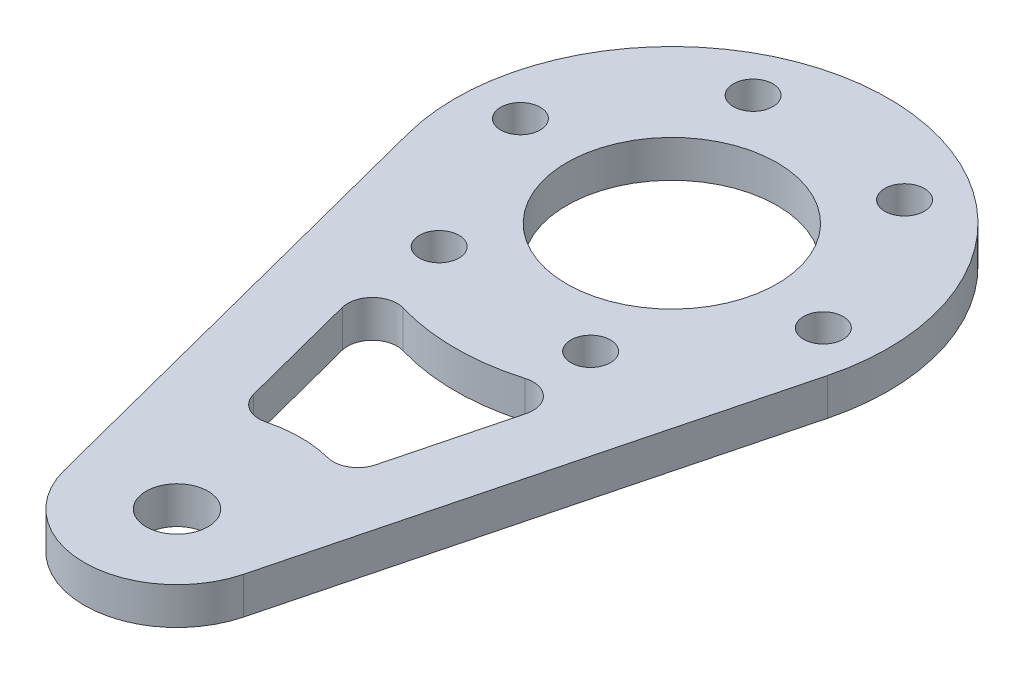
from build123d import *

# Parameters (mm, degrees)
SKETCH_1_R               = 17.5
SKETCH_1_R_2             = 7.5
SKETCH_1_R_3             = 2.5
EXTRUDE_1_DEPTH          = 3
SKETCH_2_R               = 1.6
SKETCH_2_R_2             = 8.5
CUT_EXTRUDE_1_DEPTH      = 4
PATTERN_CIRCULAR_1_COUNT = 2
CUT_EXTRUDE_2_DEPTH      = 4
FILLET_1_R               = 2


with BuildPart() as part:
    # 草图1 → 凸台-拉伸1 (new body)
    # profile 1 of 3: a face of its own
    with BuildSketch(Plane(origin=(0, 0, 0), x_dir=(1, 0, 0), z_dir=(0, 1, 0))):
        Circle(SKETCH_1_R)
    # profile 2 of 3: a face of its own
    with BuildSketch(Plane(origin=(0, 0, 0), x_dir=(1, 0, 0), z_dir=(0, 1, 0))):
        with BuildLine():
            Line((-16.94430214, -4.375), (-7.261843774, -41.875))
            ThreePointArc((-7.261843774, -41.875), (-0.945032194, -32.559777278), (7.5, -40))
            ThreePointArc((7.5, -40), (7.440222722, -40.945032194), (7.261843774, -41.875))
            Line((7.261843774, -41.875), (16.94430214, -4.375))
            ThreePointArc((16.94430214, -4.375), (0, -17.5), (-16.94430214, -4.375))
        make_face()
    # profile 3 of 3: a face of its own
    with BuildSketch(Plane(origin=(0, 0, 0), x_dir=(1, 0, 0), z_dir=(0, 1, 0))):
        with Locations((0, -40)):
            Circle(SKETCH_1_R_2)
        with Locations(Location((0, -40, 0), (0, 0, 270))):
            Circle(SKETCH_1_R_3, mode=Mode.SUBTRACT)
    extrude(amount=EXTRUDE_1_DEPTH)

    # 草图2 → 切除-拉伸1 (cut)
    with BuildSketch(Plane.XZ):
        with Locations(Location((13.446267609, 1.203281922, 0), (0, 0, 270))):
            Circle(SKETCH_2_R)
        with Locations(Location((-5.681061093, -12.246450296, 0), (0, 0, 270))):
            Circle(SKETCH_2_R)
        with Locations(Location((-7.765206517, 11.043168375, 0), (0, 0, 270))):
            Circle(SKETCH_2_R)
        with Locations(Location((0, 0, 0), (0, 0, 270))):
            Circle(SKETCH_2_R_2)
    cut_extrude_1 = extrude(amount=-CUT_EXTRUDE_1_DEPTH, mode=Mode.SUBTRACT)

    # 阵列(圆周)1: 切除-拉伸1 ×2 about axis
    pattern_circular_1_axis = Axis((0, 0, 0), (0, 1, 0))
    for i in range(1, PATTERN_CIRCULAR_1_COUNT):
        add(cut_extrude_1.rotate(pattern_circular_1_axis, i * 360 / PATTERN_CIRCULAR_1_COUNT), mode=Mode.SUBTRACT)

    # 草图3 → 切除-拉伸2 (cut)
    with BuildSketch(Plane.XZ):
        with BuildLine():
            ThreePointArc((-8.434515238, 15.33326295), (0, 17.5), (8.434515238, 15.33326295))
            Line((8.434515238, 15.33326295), (4.385981416, 31.013167019))
            ThreePointArc((4.385981416, 31.013167019), (0, 30), (-4.385981416, 31.013167019))
            Line((-4.385981416, 31.013167019), (-8.434515238, 15.33326295))
        make_face()
    extrude(amount=-CUT_EXTRUDE_2_DEPTH, mode=Mode.SUBTRACT)

    # 圆角1
    fillet_1_edges = [part.edges().sort_by_distance(p)[0] for p in [
        (-4.385981416, 1.5, 31.013167019),
        (4.385981416, 1.5, 31.013167019),
        (8.434515238, 1.5, 15.33326295),
        (-8.434515238, 1.5, 15.33326295),
    ]]
    fillet(fillet_1_edges, radius=FILLET_1_R)


solid = part.part
